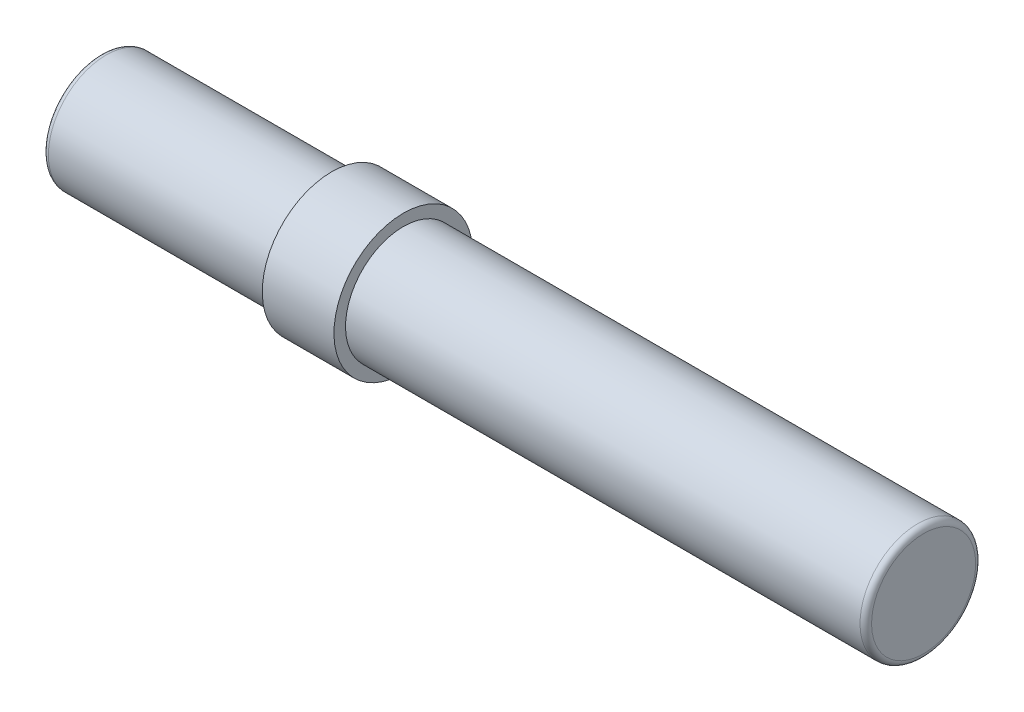
from build123d import *

# Parameters (mm, degrees)
VERRUNDUNG1_R = 0.5


with BuildPart() as part:
    # Skizze1 → Rotation1 (revolve)
    with BuildSketch(Plane.XY):
        Polygon((-47.114311418, 0), (-47.114311418, 5), (-27.114311418, 5), (-27.114311418, 6), (-20.914311418, 6), (-20.914311418, 5), (24.085688582, 5), (24.085688582, 0), align=None)
    revolve(axis=Axis((24.085688582, 0, 0), (-1, 0, 0)))

    # Verrundung1
    verrundung1_edges = [part.edges().sort_by_distance(p)[0] for p in [
        (24.085688582, -5, 0),
        (-47.114311418, -5, 0),
    ]]
    fillet(verrundung1_edges, radius=VERRUNDUNG1_R)


solid = part.part
